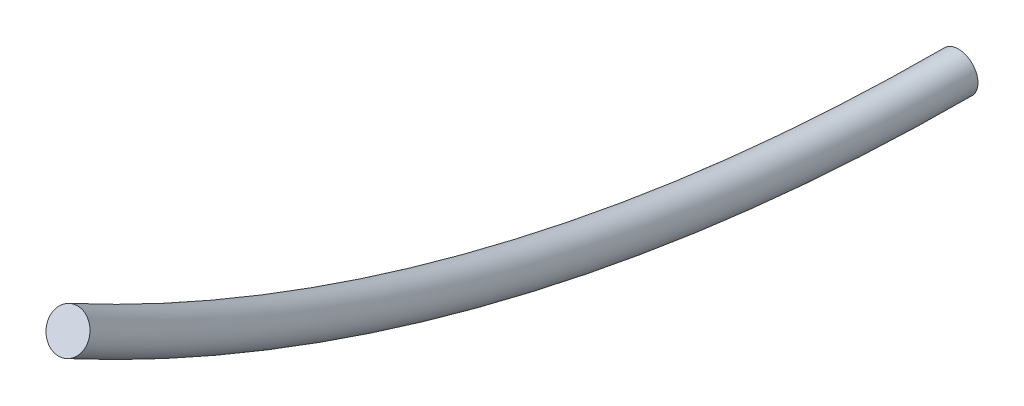
from build123d import *

# Parameters (mm, degrees)
SKETCH1_R = 50.799999993


with BuildPart() as part:
    # Sweep1: sweep along a path in Sketch2
    with BuildLine(Plane(origin=(3213.983861817, -133.279117208, 0), x_dir=(-0.04119620402559296, -0.9934334626492767, 0.10673719156203237), z_dir=(-0.9991412887452005, 0.04143289906077211, -3.3601593729670753e-15))) as sweep1_path:
        ThreePointArc((13037.246925552, -1399.554402186), (13014.958874634, -183.744942107), (12691.932842026, 988.579067154))
    # Sketch1 → Sweep1 (sweep)
    with BuildSketch(Plane(origin=(25457.389398643, 23216.374153079, -8.77e-07), x_dir=(-0.5236120127653583, 0.8519568416814378, 0), z_dir=(0, 0, -1))):
        with Locations((-19122.913368791, -38499.212176653)):
            Circle(SKETCH1_R)
    sweep(path=sweep1_path.line)


solid = part.part
